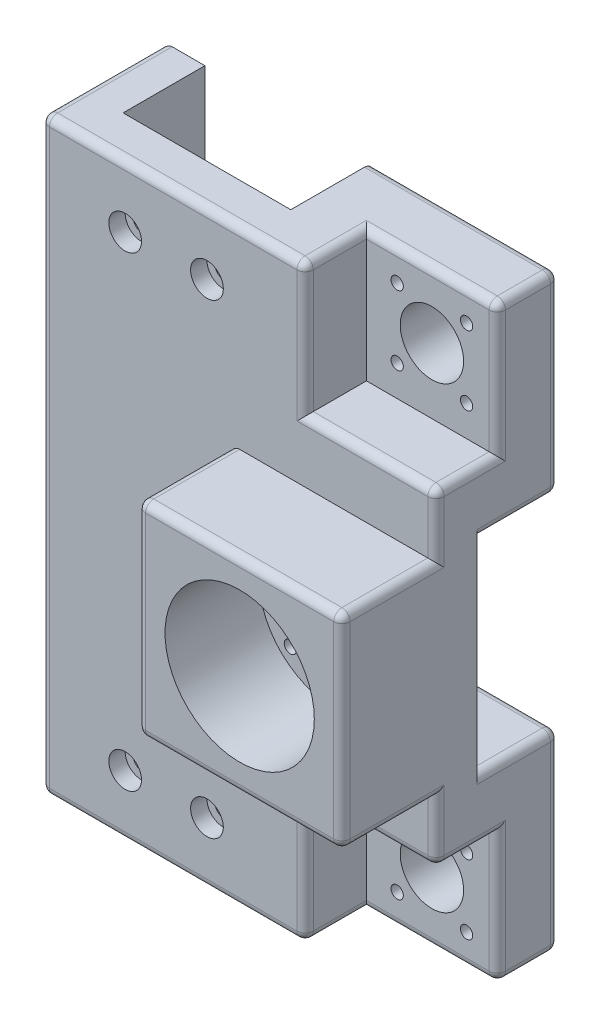
from build123d import *

# Parameters (mm, degrees)
SKETCH3_W           = 118.5
SKETCH3_H           = 144
BOSS_EXTRUDE1_DEPTH = 30
SKETCH4_R           = 11
CUT_EXTRUDE1_DEPTH  = 2
SKETCH5_R           = 4
CUT_EXTRUDE2_DEPTH  = 30
SKETCH7_W           = 41
SKETCH7_H           = 177.768192582
CUT_EXTRUDE4_DEPTH  = 20
SKETCH8_W           = 86.017782004
SKETCH8_H           = 50
CUT_EXTRUDE5_DEPTH  = 20
SKETCH9_R           = 7.5
CUT_EXTRUDE6_DEPTH  = 30
SKETCH10_W          = 32
SKETCH10_H          = 32
CUT_EXTRUDE7_DEPTH  = 15
SKETCH14_R          = 2
CUT_EXTRUDE10_DEPTH = 15
SKETCH15_R          = 2
CUT_EXTRUDE11_DEPTH = 34
SKETCH16_R          = 4
CUT_EXTRUDE12_DEPTH = 26
SKETCH17_W          = 32
SKETCH17_H          = 32
BOSS_EXTRUDE2_DEPTH = 15
SKETCH18_W          = 10
SKETCH18_H          = 30
BOSS_EXTRUDE3_DEPTH = 144
SKETCH19_W          = 22
SKETCH19_H          = 30
CUT_EXTRUDE13_DEPTH = 144
SKETCH20_R          = 2
CUT_EXTRUDE14_DEPTH = 10
SKETCH21_R          = 7.75
CUT_EXTRUDE15_DEPTH = 15
SKETCH22_R          = 4
CUT_EXTRUDE16_DEPTH = 4
SKETCH23_R          = 4
CUT_EXTRUDE17_DEPTH = 4
BOSS_EXTRUDE4_START = -10
SKETCH24_R          = 2
BOSS_EXTRUDE4_DEPTH = 10
SKETCH25_R          = 5
CUT_EXTRUDE18_DEPTH = 10
SKETCH26_R          = 1.5
CUT_EXTRUDE19_DEPTH = 15
SKETCH27_R          = 11.25
CUT_EXTRUDE20_DEPTH = 2
SKETCH28_W          = 50
SKETCH28_H          = 50
SKETCH28_R          = 18.25
BOSS_EXTRUDE5_DEPTH = 23
SKETCH29_R          = 1.5
CUT_EXTRUDE21_DEPTH = 10
FILLET1_R           = 2


with BuildPart() as part:
    # Sketch3 → Boss-Extrude1 (new body)
    with BuildSketch(Plane.XY):
        Rectangle(SKETCH3_W, SKETCH3_H)
    extrude(amount=-BOSS_EXTRUDE1_DEPTH)

    # Sketch4 → Cut-Extrude1 (cut)
    with BuildSketch(Plane.XY):
        with Locations((34.25, 0)):
            Circle(SKETCH4_R)
    extrude(amount=-CUT_EXTRUDE1_DEPTH, mode=Mode.SUBTRACT)

    # Sketch5 → Cut-Extrude2 (cut)
    with BuildSketch(Plane.XY.offset(-2)):
        with Locations((34.25, 0)):
            Circle(SKETCH5_R)
    extrude(amount=-CUT_EXTRUDE2_DEPTH, mode=Mode.SUBTRACT)

    # Sketch7 → Cut-Extrude4 (cut)
    with BuildSketch(Plane(origin=(0, 0, -30), x_dir=(-1, 0, 0), z_dir=(0, 0, -1))):
        with Locations((6.75, 0)):
            Rectangle(SKETCH7_W, SKETCH7_H)
    extrude(amount=-CUT_EXTRUDE4_DEPTH, mode=Mode.SUBTRACT)

    # Sketch8 → Cut-Extrude5 (cut)
    with BuildSketch(Plane(origin=(0, 0, -30), x_dir=(-1, 0, 0), z_dir=(0, 0, -1))):
        with Locations((-34.25, 0)):
            Rectangle(SKETCH8_W, SKETCH8_H)
    extrude(amount=-CUT_EXTRUDE5_DEPTH, mode=Mode.SUBTRACT)

    # Sketch9 → Cut-Extrude6 (cut)
    with BuildSketch(Plane.XY):
        with Locations((-43.25, 0)):
            Circle(SKETCH9_R)
        with Locations((43.25, -56)):
            Circle(SKETCH9_R)
        with Locations((43.25, 56)):
            Circle(SKETCH9_R)
    extrude(amount=-CUT_EXTRUDE6_DEPTH, mode=Mode.SUBTRACT)

    # Sketch10 → Cut-Extrude7 (cut)
    with BuildSketch(Plane.XY):
        with Locations((-43.25, 0)):
            Rectangle(SKETCH10_W, SKETCH10_H)
        with Locations((43.25, 56)):
            Rectangle(SKETCH10_W, SKETCH10_H)
        with Locations((43.25, -56)):
            Rectangle(SKETCH10_W, SKETCH10_H)
    extrude(amount=-CUT_EXTRUDE7_DEPTH, mode=Mode.SUBTRACT)

    # Sketch14 → Cut-Extrude10 (cut)
    with BuildSketch(Plane(origin=(0, 0, -10), x_dir=(-1, 0, 0), z_dir=(0, 0, -1))):
        with Locations((16.75, 0)):
            Circle(SKETCH14_R)
        with Locations((-3.25, 0)):
            Circle(SKETCH14_R)
        with Locations((16.75, 57)):
            Circle(SKETCH14_R)
        with Locations((-3.25, 57)):
            Circle(SKETCH14_R)
        with Locations((16.75, -57)):
            Circle(SKETCH14_R)
        with Locations((-3.25, -57)):
            Circle(SKETCH14_R)
    extrude(amount=-CUT_EXTRUDE10_DEPTH, mode=Mode.SUBTRACT)

    # Sketch15 → Cut-Extrude11 (cut)
    with BuildSketch(Plane.ZY.offset(59.25)):
        with Locations((-20, 44)):
            Circle(SKETCH15_R)
        with Locations((-20, -44)):
            Circle(SKETCH15_R)
    extrude(amount=-CUT_EXTRUDE11_DEPTH, mode=Mode.SUBTRACT)

    # Sketch16 → Cut-Extrude12 (cut)
    with BuildSketch(Plane.ZY.offset(59.25)):
        with Locations((-20, 44)):
            Circle(SKETCH16_R)
        with Locations((-20, -44)):
            Circle(SKETCH16_R)
    extrude(amount=-CUT_EXTRUDE12_DEPTH, mode=Mode.SUBTRACT)

    # Sketch17 → Boss-Extrude2 (add)
    with BuildSketch(Plane.XY.offset(-15)):
        with Locations((-43.25, 0)):
            Rectangle(SKETCH17_W, SKETCH17_H)
    extrude(amount=BOSS_EXTRUDE2_DEPTH)

    # Sketch18 → Boss-Extrude3 (add)
    with BuildSketch(Plane(origin=(0, 72, 0), x_dir=(1, 0, 0), z_dir=(0, 1, 0))):
        with Locations((-32.25, 15)):
            Rectangle(SKETCH18_W, SKETCH18_H)
    extrude(amount=-BOSS_EXTRUDE3_DEPTH)

    # Sketch19 → Cut-Extrude13 (cut)
    with BuildSketch(Plane(origin=(0, 72, 0), x_dir=(1, 0, 0), z_dir=(0, 1, 0))):
        with Locations((-48.25, 15)):
            Rectangle(SKETCH19_W, SKETCH19_H)
    extrude(amount=-CUT_EXTRUDE13_DEPTH, mode=Mode.SUBTRACT)

    # Sketch20 → Cut-Extrude14 (cut)
    with BuildSketch(Plane(origin=(-27.25, 0, 0), x_dir=(0, 0, -1), z_dir=(1, 0, 0))):
        with Locations((20, -50)):
            Circle(SKETCH20_R)
        with Locations((20, 0)):
            Circle(SKETCH20_R)
        with Locations((20, 50)):
            Circle(SKETCH20_R)
    extrude(amount=-CUT_EXTRUDE14_DEPTH, mode=Mode.SUBTRACT)

    # Sketch21 → Cut-Extrude15 (cut)
    with BuildSketch(Plane.XY.offset(-15)):
        with Locations((43.25, -56)):
            Circle(SKETCH21_R)
        with Locations((43.25, 56)):
            Circle(SKETCH21_R)
    extrude(amount=-CUT_EXTRUDE15_DEPTH, mode=Mode.SUBTRACT)

    # Sketch22 → Cut-Extrude16 (cut)
    with BuildSketch(Plane.ZY.offset(37.25)):
        with Locations((-20, 50)):
            Circle(SKETCH22_R)
        with Locations((-20, 0)):
            Circle(SKETCH22_R)
        with Locations((-20, -50)):
            Circle(SKETCH22_R)
    extrude(amount=-CUT_EXTRUDE16_DEPTH, mode=Mode.SUBTRACT)

    # Sketch23 → Cut-Extrude17 (cut)
    with BuildSketch(Plane.XY):
        with Locations((-16.75, 57)):
            Circle(SKETCH23_R)
        with Locations((3.25, 57)):
            Circle(SKETCH23_R)
        with Locations((-16.75, -57)):
            Circle(SKETCH23_R)
        with Locations((3.25, -57)):
            Circle(SKETCH23_R)
    extrude(amount=-CUT_EXTRUDE17_DEPTH, mode=Mode.SUBTRACT)

    # Sketch24 → Boss-Extrude4 (add)
    with BuildSketch(Plane.XY.offset(BOSS_EXTRUDE4_START)):
        with Locations((-16.75, 0)):
            Circle(SKETCH24_R)
        with Locations((3.25, 0)):
            Circle(SKETCH24_R)
    extrude(amount=BOSS_EXTRUDE4_DEPTH)

    # Sketch25 → Cut-Extrude18 (cut)
    with BuildSketch(Plane.XY.offset(-2)):
        with Locations((34.25, 0)):
            Circle(SKETCH25_R)
    extrude(amount=-CUT_EXTRUDE18_DEPTH, mode=Mode.SUBTRACT)

    # Sketch26 → Cut-Extrude19 (cut)
    with BuildSketch(Plane.XY.offset(-15)):
        with Locations((34.764718626, -64.485281374)):
            Circle(SKETCH26_R)
        with Locations((34.764718626, -47.514718626)):
            Circle(SKETCH26_R)
        with Locations((51.735281374, -47.514718626)):
            Circle(SKETCH26_R)
        with Locations((51.735281374, -64.485281374)):
            Circle(SKETCH26_R)
        with Locations((34.764718626, 47.514718626)):
            Circle(SKETCH26_R)
        with Locations((51.735281374, 47.514718626)):
            Circle(SKETCH26_R)
        with Locations((51.735281374, 64.485281374)):
            Circle(SKETCH26_R)
        with Locations((34.764718626, 64.485281374)):
            Circle(SKETCH26_R)
    extrude(amount=-CUT_EXTRUDE19_DEPTH, mode=Mode.SUBTRACT)

    # Sketch27 → Cut-Extrude20 (cut)
    with BuildSketch(Plane.XY):
        with Locations((34.25, 0)):
            Circle(SKETCH27_R)
    extrude(amount=-CUT_EXTRUDE20_DEPTH, mode=Mode.SUBTRACT)

    # Sketch28 → Boss-Extrude5 (add)
    with BuildSketch(Plane.XY):
        with Locations((34.25, 0)):
            Rectangle(SKETCH28_W, SKETCH28_H)
        with Locations((34.25, 0)):
            Circle(SKETCH28_R, mode=Mode.SUBTRACT)
    extrude(amount=BOSS_EXTRUDE5_DEPTH)

    # Sketch29 → Cut-Extrude21 (cut)
    with BuildSketch(Plane(origin=(0, 0, -10), x_dir=(-1, 0, 0), z_dir=(0, 0, -1))):
        with Locations((-23.643398282, 10.606601718)):
            Circle(SKETCH29_R)
        with Locations((-23.643398282, -10.606601718)):
            Circle(SKETCH29_R)
        with Locations((-44.856601718, 10.606601718)):
            Circle(SKETCH29_R)
        with Locations((-44.856601718, -10.606601718)):
            Circle(SKETCH29_R)
    extrude(amount=-CUT_EXTRUDE21_DEPTH, mode=Mode.SUBTRACT)

    # Fillet1
    fillet1_edges = [part.edges().sort_by_distance(p)[0] for p in [
        (-37.25, 72, -15),
        (-37.25, -72, -15),
        (-37.25, 0, -30),
        (-37.25, 0, 0),
        (43.25, -72, -15),
        (36.5, -72, -30),
        (36.5, -25, -30),
        (36.5, 25, -30),
        (36.5, 72, -30),
        (-5, 72, 0),
        (27.25, 56, 0),
        (43.25, 40, 0),
        (59.25, 25, 11.5),
        (9.25, 25, 11.5),
        (9.25, -25, 11.5),
        (34.25, 25, 23),
        (9.25, 0, 23),
        (34.25, -25, 23),
        (59.25, 0, 23),
        (59.25, -25, 11.5),
        (43.25, -40, 0),
        (27.25, -56, 0),
        (27.25, -72, -7.5),
        (59.25, -40, -7.5),
        (27.25, 72, -7.5),
        (59.25, 40, -7.5),
        (59.25, 72, -22.5),
        (59.25, 48.5, -30),
        (59.25, 25, -20),
        (59.25, -48.5, -30),
        (59.25, -25, -20),
        (59.25, -72, -22.5),
        (-5, -72, 0),
        (59.25, -56, -15),
        (59.25, 56, -15),
        (59.25, 32.5, 0),
        (59.25, -32.5, 0),
        (43.25, 72, -15),
    ]]
    fillet(fillet1_edges, radius=FILLET1_R)


solid = part.part
